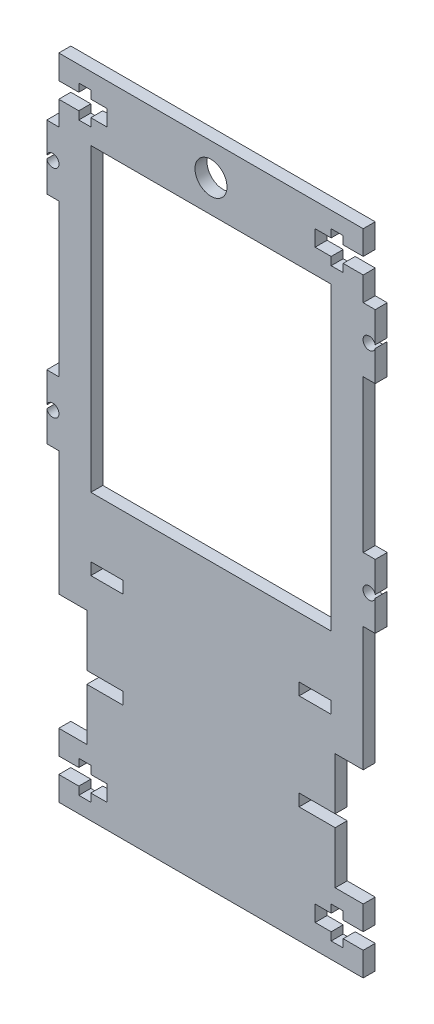
from build123d import *

# Parameters (mm, degrees)
SKETCH_1_W      = 8
SKETCH_1_H      = 3
SKETCH_1_R      = 4
EXTRUDE_1_DEPTH = 3


with BuildPart() as part:
    # 草图1 → 凸台-拉伸1 (new body)
    with BuildSketch(Plane.XY):
        with BuildLine():
            Line((38, 80), (38, 86))
            Line((38, 86), (-38, 86))
            Line((-38, 86), (-38, 80))
            Line((-38, 80), (-33, 80))
            Line((-33, 80), (-33, 82))
            Line((-33, 82), (-30, 82))
            Line((-30, 82), (-30, 80))
            Line((-30, 80), (-26, 80))
            Line((-26, 80), (-26, 76))
            Line((-26, 76), (-30, 76))
            Line((-30, 76), (-30, 74))
            Line((-30, 74), (-33, 74))
            Line((-33, 74), (-33, 76))
            Line((-33, 76), (-38, 76))
            Line((-38, 76), (-38, 70))
            Line((-38, 70), (-41, 70))
            Line((-41, 70), (-41, 62.390512484))
            ThreePointArc((-41, 62.390512484), (-37.95, 62), (-41, 61.609487516))
            Line((-41, 61.609487516), (-41, 54))
            Line((-41, 54), (-38, 54))
            Line((-38, 54), (-38, 16))
            Line((-38, 16), (-41, 16))
            Line((-41, 16), (-41, 8.390512484))
            ThreePointArc((-41, 8.390512484), (-37.95, 8), (-41, 7.609487516))
            Line((-41, 7.609487516), (-41, 0))
            Line((-41, 0), (-38, 0))
            Line((-38, 0), (-38, -31))
            Line((-38, -31), (-31, -31))
            Line((-31, -31), (-31, -44))
            Line((-31, -44), (-22, -44))
            Line((-22, -44), (-22, -47))
            Line((-22, -47), (-31, -47))
            Line((-31, -47), (-31, -60))
            Line((-31, -60), (-38, -60))
            Line((-38, -60), (-38, -66))
            Line((-38, -66), (-33, -66))
            Line((-33, -66), (-33, -64))
            Line((-33, -64), (-30, -64))
            Line((-30, -64), (-30, -66))
            Line((-30, -66), (-26, -66))
            Line((-26, -66), (-26, -70))
            Line((-26, -70), (-30, -70))
            Line((-30, -70), (-30, -72))
            Line((-30, -72), (-33, -72))
            Line((-33, -72), (-33, -70))
            Line((-33, -70), (-38, -70))
            Line((-38, -70), (-38, -76))
            Line((-38, -76), (38, -76))
            Line((38, -76), (38, -70))
            Line((38, -70), (33, -70))
            Line((33, -70), (33, -72))
            Line((33, -72), (30, -72))
            Line((30, -72), (30, -70))
            Line((30, -70), (26, -70))
            Line((26, -70), (26, -66))
            Line((26, -66), (30, -66))
            Line((30, -66), (30, -64))
            Line((30, -64), (33, -64))
            Line((33, -64), (33, -66))
            Line((33, -66), (38, -66))
            Line((38, -66), (38, -60))
            Line((38, -60), (31, -60))
            Line((31, -60), (31, -47))
            Line((31, -47), (22, -47))
            Line((22, -47), (22, -44))
            Line((22, -44), (31, -44))
            Line((31, -44), (31, -31))
            Line((31, -31), (38, -31))
            Line((38, -31), (38, 0))
            Line((38, 0), (41, 0))
            Line((41, 0), (41, 7.609487516))
            ThreePointArc((41, 7.609487516), (37.95, 8), (41, 8.390512484))
            Line((41, 8.390512484), (41, 16))
            Line((41, 16), (38, 16))
            Line((38, 16), (38, 54))
            Line((38, 54), (41, 54))
            Line((41, 54), (41, 61.609487516))
            ThreePointArc((41, 61.609487516), (37.95, 62), (41, 62.390512484))
            Line((41, 62.390512484), (41, 70))
            Line((41, 70), (38, 70))
            Line((38, 70), (38, 76))
            Line((38, 76), (33, 76))
            Line((33, 76), (33, 74))
            Line((33, 74), (30, 74))
            Line((30, 74), (30, 76))
            Line((30, 76), (26, 76))
            Line((26, 76), (26, 80))
            Line((26, 80), (30, 80))
            Line((30, 80), (30, 82))
            Line((30, 82), (33, 82))
            Line((33, 82), (33, 80))
            Line((33, 80), (38, 80))
        make_face()
        with Locations((-26, -21.5)):
            Rectangle(SKETCH_1_W, SKETCH_1_H, mode=Mode.SUBTRACT)
        with Locations((26, -21.5)):
            Rectangle(SKETCH_1_W, SKETCH_1_H, mode=Mode.SUBTRACT)
        Polygon((-30, -5), (-30, 0), (-30, 70), (30, 70), (30, 0), (30, -5), align=None, mode=Mode.SUBTRACT)
        with Locations((0, 78)):
            Circle(SKETCH_1_R, mode=Mode.SUBTRACT)
    extrude(amount=EXTRUDE_1_DEPTH)


solid = part.part
